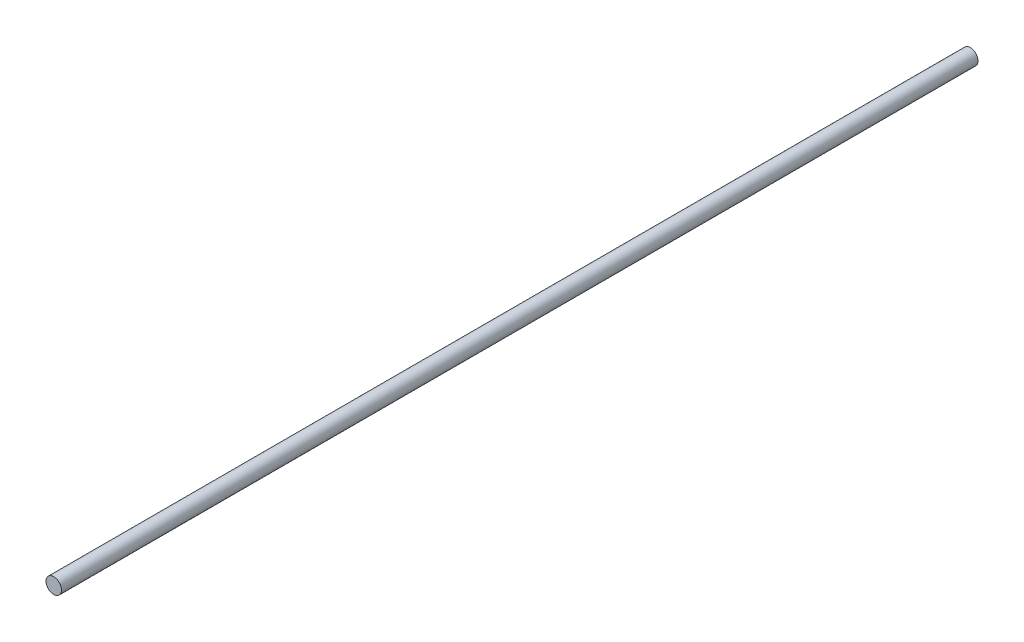
from build123d import *

# Parameters (mm, degrees)
SZKIC1_R                    = 4
DODANIE_WYCI_GNI_CIE1_DEPTH = 475


with BuildPart() as part:
    # Szkic1 → Dodanie-wyciągnięcie1 (new body)
    with BuildSketch(Plane.XY):
        with Locations(Location((0, 0, 0), (0, 0, 180))):
            Circle(SZKIC1_R)
    extrude(amount=DODANIE_WYCI_GNI_CIE1_DEPTH)


solid = part.part
